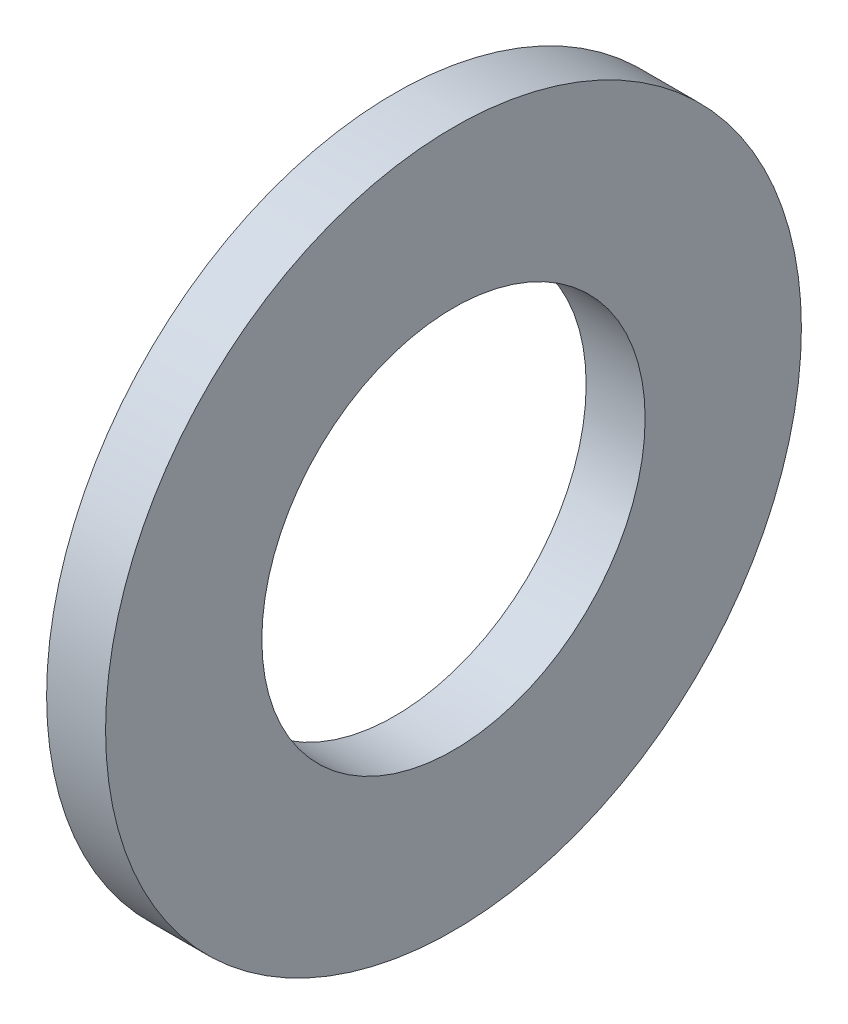
from build123d import *

# Parameters (mm, degrees)
SKETCH1_R           = 5.9
SKETCH1_R_2         = 3.25
BOSS_EXTRUDE1_DEPTH = 1


with BuildPart() as part:
    # Sketch1 → Boss-Extrude1 (new body)
    with BuildSketch(Plane(origin=(0, 0, 0), x_dir=(0, 0, -1), z_dir=(1, 0, 0))):
        Circle(SKETCH1_R)
        Circle(SKETCH1_R_2, mode=Mode.SUBTRACT)
    extrude(amount=BOSS_EXTRUDE1_DEPTH)


solid = part.part
